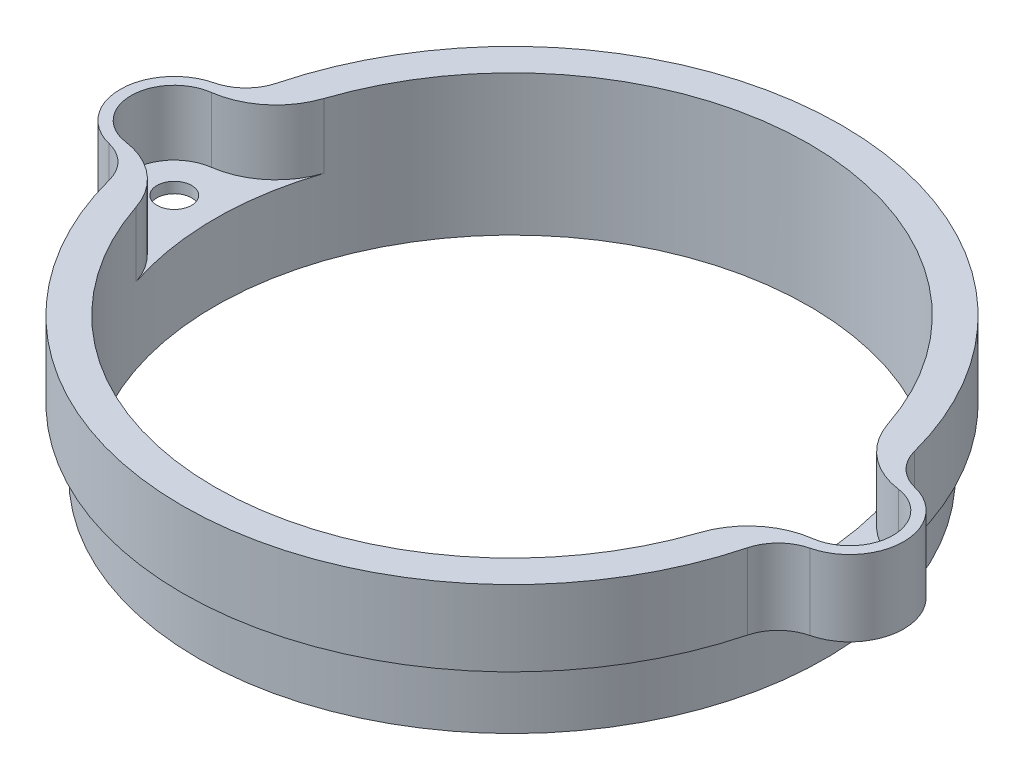
from build123d import *

# Parameters (mm, degrees)
SKETCH1_R           = 29
SKETCH1_R_2         = 27.5
BOSS_EXTRUDE1_DEPTH = 6
SKETCH3_R           = 30.5
SKETCH3_R_2         = 27.5
BOSS_EXTRUDE3_DEPTH = 7
BOSS_EXTRUDE4_START = -6
BOSS_EXTRUDE4_DEPTH = 6
CUT_EXTRUDE1_START  = -7
SKETCH6_R           = 4
CUT_EXTRUDE1_DEPTH  = 7
BOSS_EXTRUDE5_START = 1
SKETCH8_R           = 4
SKETCH8_R_2         = 1.6
BOSS_EXTRUDE5_DEPTH = 1
CUT_EXTRUDE2_START  = -6
CUT_EXTRUDE2_DEPTH  = 6
CUT_EXTRUDE3_START  = -10
SKETCH10_R          = 27.5
CUT_EXTRUDE3_DEPTH  = 10
CIRPATTERN1_COUNT   = 2


with BuildPart() as part:
    # Sketch1 → Boss-Extrude1 (new body)
    with BuildSketch(Plane(origin=(0, 0, 0), x_dir=(1, 0, 0), z_dir=(0, 1, 0))):
        with Locations(Location((0, 0, 0), (0, 0, 270))):
            Circle(SKETCH1_R)
        with Locations(Location((0, 0, 0), (0, 0, 270))):
            Circle(SKETCH1_R_2, mode=Mode.SUBTRACT)
    extrude(amount=BOSS_EXTRUDE1_DEPTH)

    # Sketch3 → Boss-Extrude3 (add)
    with BuildSketch(Plane(origin=(0, 6, 0), x_dir=(1, 0, 0), z_dir=(0, 1, 0))):
        with Locations(Location((0, 0, 0), (0, 0, 270))):
            Circle(SKETCH3_R)
        with Locations(Location((0, 0, 0), (0, 0, 270))):
            Circle(SKETCH3_R_2, mode=Mode.SUBTRACT)
    extrude(amount=BOSS_EXTRUDE3_DEPTH)

    # Sketch4 → Boss-Extrude4 (add)
    with BuildSketch(Plane(origin=(0, 13, 0), x_dir=(1, 0, 0), z_dir=(0, 1, 0)).offset(BOSS_EXTRUDE4_START)):
        with BuildLine():
            ThreePointArc((-30.253, -3.873756704), (-35.25, 0), (-30.253, 3.873756704))
            ThreePointArc((-30.253, 3.873756704), (-30.245409649, 3.932581236), (-30.237704918, 3.991390897))
            ThreePointArc((-30.237704918, 3.991390897), (-29.929181214, 5.873168807), (-29.503666667, 7.731988956))
            ThreePointArc((-29.503666667, 7.731988956), (-30.570387885, 5.892011652), (-32.429444444, 4.858900164))
            ThreePointArc((-32.429444444, 4.858900164), (-36.25, 0), (-32.429444444, -4.858900164))
            ThreePointArc((-32.429444444, -4.858900164), (-30.570387885, -5.892011652), (-29.503666667, -7.731988956))
            ThreePointArc((-29.503666667, -7.731988956), (-29.929181214, -5.873168807), (-30.237704918, -3.991390897))
            ThreePointArc((-30.237704918, -3.991390897), (-30.245409649, -3.932581236), (-30.253, -3.873756704))
        make_face()
    boss_extrude4 = extrude(amount=BOSS_EXTRUDE4_DEPTH)

    # Sketch6 → Cut-Extrude1 (cut)
    with BuildSketch(Plane(origin=(0, 13, 0), x_dir=(1, 0, 0), z_dir=(0, 1, 0)).offset(CUT_EXTRUDE1_START)):
        with Locations((-31.25, 0)):
            Circle(SKETCH6_R)
    cut_extrude1 = extrude(amount=CUT_EXTRUDE1_DEPTH, mode=Mode.SUBTRACT)

    # Sketch8 → Boss-Extrude5 (add)
    # profile 1 of 2: a face of its own
    with BuildSketch(Plane.XZ.offset(-7).offset(BOSS_EXTRUDE5_START)):
        with Locations((-31.25, 0)):
            Circle(SKETCH8_R)
        with Locations(Location((-31.25, 0, 0), (0, 0, 270))):
            Circle(SKETCH8_R_2, mode=Mode.SUBTRACT)
    # profile 2 of 2: a face of its own
    with BuildSketch(Plane.XZ.offset(-7).offset(BOSS_EXTRUDE5_START)):
        with BuildLine():
            ThreePointArc((-30.253, -3.873756704), (-29.94054595, -5.814955562), (-29.503666667, -7.731988956))
            ThreePointArc((-29.503666667, -7.731988956), (-30.570387885, -5.892011652), (-32.429444444, -4.858900164))
            ThreePointArc((-32.429444444, -4.858900164), (-36.25, 0), (-32.429444444, 4.858900164))
            ThreePointArc((-32.429444444, 4.858900164), (-30.570387885, 5.892011652), (-29.503666667, 7.731988956))
            ThreePointArc((-29.503666667, 7.731988956), (-29.94054595, 5.814955562), (-30.253, 3.873756704))
            ThreePointArc((-30.253, 3.873756704), (-35.25, 0), (-30.253, -3.873756704))
        make_face()
    boss_extrude5 = extrude(amount=-BOSS_EXTRUDE5_DEPTH)

    # Sketch9 → Cut-Extrude2 (cut)
    with BuildSketch(Plane(origin=(0, 13, 0), x_dir=(1, 0, 0), z_dir=(0, 1, 0)).offset(CUT_EXTRUDE2_START)):
        with BuildLine():
            ThreePointArc((-27.469, 1.305388448), (-27.033467309, 5.04397118), (-26.091521739, 8.688066145))
            ThreePointArc((-26.091521739, 8.688066145), (-28.264861577, 5.511091819), (-31.789272727, 3.963481415))
            ThreePointArc((-31.789272727, 3.963481415), (-29.15391711, 3.406822055), (-27.469, 1.305388448))
        make_face()
        with BuildLine():
            ThreePointArc((-31.789272727, -3.963481415), (-28.264861577, -5.511091819), (-26.091521739, -8.688066145))
            ThreePointArc((-26.091521739, -8.688066145), (-27.033467309, -5.04397118), (-27.469, -1.305388448))
            ThreePointArc((-27.469, -1.305388448), (-29.15391711, -3.406822055), (-31.789272727, -3.963481415))
        make_face()
    cut_extrude2 = extrude(amount=CUT_EXTRUDE2_DEPTH, mode=Mode.SUBTRACT)

    # Sketch10 → Cut-Extrude3 (cut)
    with BuildSketch(Plane(origin=(0, 7, 0), x_dir=(1, 0, 0), z_dir=(0, 1, 0)).offset(CUT_EXTRUDE3_START)):
        with Locations(Location((0, 0, 0), (0, 0, 161.583053277))):
            Circle(SKETCH10_R)
    cut_extrude3 = extrude(amount=CUT_EXTRUDE3_DEPTH, mode=Mode.SUBTRACT)

    # CirPattern1: Boss-Extrude4, Cut-Extrude1, Boss-Extrude5, Cut-Extrude2, Cut-Extrude3 ×2 about axis
    cirpattern1_axis = Axis((0, 0, 0), (0, 1, 0))
    add([boss_extrude4.rotate(cirpattern1_axis, i * 360 / CIRPATTERN1_COUNT) for i in range(1, CIRPATTERN1_COUNT)])
    add([cut_extrude1.rotate(cirpattern1_axis, i * 360 / CIRPATTERN1_COUNT) for i in range(1, CIRPATTERN1_COUNT)], mode=Mode.SUBTRACT)
    add([boss_extrude5.rotate(cirpattern1_axis, i * 360 / CIRPATTERN1_COUNT) for i in range(1, CIRPATTERN1_COUNT)])
    add([cut_extrude2.rotate(cirpattern1_axis, i * 360 / CIRPATTERN1_COUNT) for i in range(1, CIRPATTERN1_COUNT)], mode=Mode.SUBTRACT)
    add([cut_extrude3.rotate(cirpattern1_axis, i * 360 / CIRPATTERN1_COUNT) for i in range(1, CIRPATTERN1_COUNT)], mode=Mode.SUBTRACT)


solid = part.part
